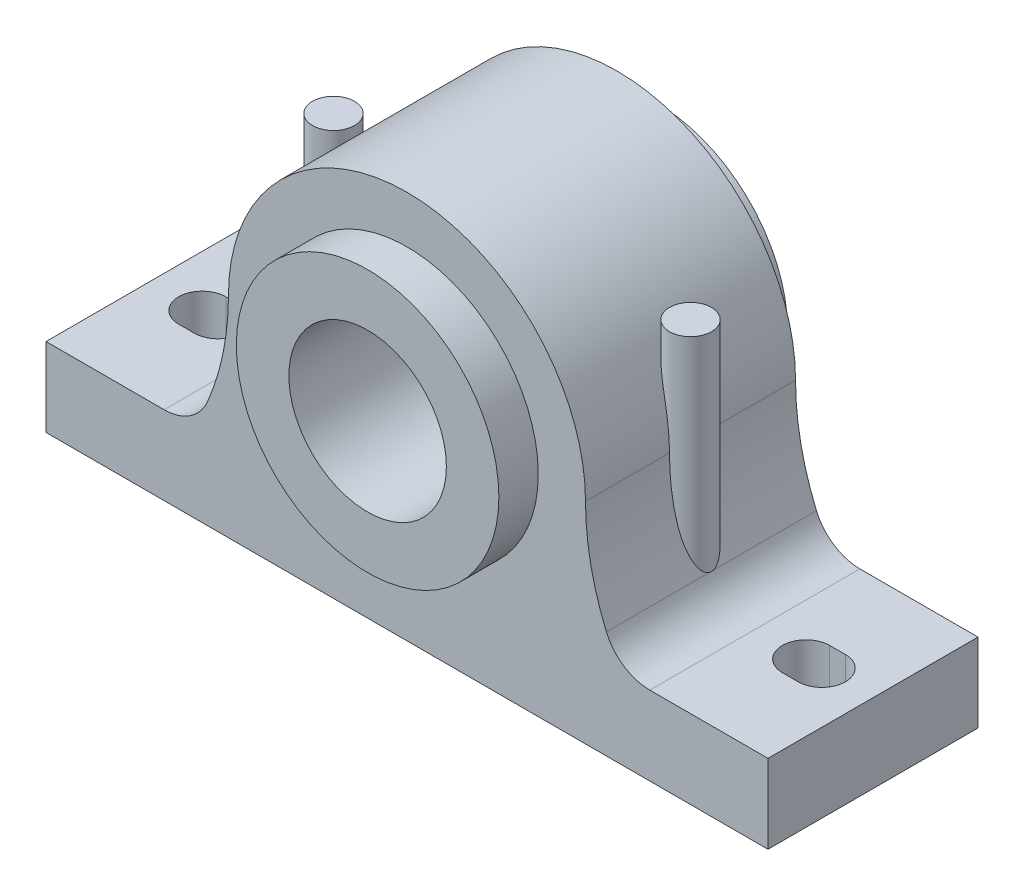
from build123d import *

# Parameters (mm, degrees)
SKETCH1_R                = 30
BOSS_EXTRUDE1_DEPTH      = 40
SKETCH2_R                = 50
SKETCH2_R_2              = 30
BOSS_EXTRUDE2_DEPTH      = 55
CUT_EXTRUDE1_DEPTH       = 110
BOSS_EXTRUDE3_DEPTH      = 40
BOSS_EXTRUDE3_DEPTH_BACK = 60
SKETCH5_R                = 8


with BuildPart() as part:
    # Sketch1 → Boss-Extrude1 (new, symmetric)
    with BuildSketch(Plane.XY):
        with BuildLine():
            Line((137.5, -80), (-137.5, -80))
            Line((-137.5, -80), (-137.5, -50))
            Line((-137.5, -50), (-92.5, -50))
            ThreePointArc((-92.5, -50), (-82.586036695, -47.018171653), (-75.961854895, -39.062156056))
            ThreePointArc((-75.961854895, -39.062156056), (-70.010718453, -19.932656428), (-68, 0))
            ThreePointArc((-68, 0), (0, 68), (68, 0))
            ThreePointArc((68, 0), (70.010718453, -19.932656428), (75.961854895, -39.062156056))
            ThreePointArc((75.961854895, -39.062156056), (82.586036695, -47.018171653), (92.5, -50))
            Line((92.5, -50), (137.5, -50))
            Line((137.5, -50), (137.5, -80))
        make_face()
        Circle(SKETCH1_R, mode=Mode.SUBTRACT)
    extrude(amount=BOSS_EXTRUDE1_DEPTH, both=True)

    # Sketch2 → Boss-Extrude2 (add, symmetric)
    with BuildSketch(Plane.XY):
        Circle(SKETCH2_R)
        Circle(SKETCH2_R_2, mode=Mode.SUBTRACT)
    extrude(amount=BOSS_EXTRUDE2_DEPTH, both=True)

    # Sketch3 → Cut-Extrude1 (cut)
    with BuildSketch(Plane(origin=(0, 0, 0), x_dir=(1, 0, 0), z_dir=(0, 1, 0))):
        with BuildLine():
            Line((-118, 9), (-112, 9))
            ThreePointArc((-112, 9), (-103, 0), (-112, -9))
            Line((-112, -9), (-118, -9))
            ThreePointArc((-118, -9), (-127, 0), (-118, 9))
        make_face()
        with BuildLine():
            Line((118, 9), (112, 9))
            ThreePointArc((112, 9), (103, 0), (112, -9))
            Line((112, -9), (118, -9))
            ThreePointArc((118, -9), (127, 0), (118, 9))
        make_face()
    extrude(amount=-CUT_EXTRUDE1_DEPTH, mode=Mode.SUBTRACT)

    # Sketch5 → Boss-Extrude3 (add, two sides: drawn at the far end of the back side and taken through both)
    with BuildSketch(Plane(origin=(0, 0, 0), x_dir=(1, 0, 0), z_dir=(0, 1, 0)).offset(-BOSS_EXTRUDE3_DEPTH_BACK)):
        with Locations(Location((-68, 0, 0), (0, 0, 270))):
            Circle(SKETCH5_R)
        with Locations(Location((68, 0, 0), (0, 0, 270))):
            Circle(SKETCH5_R)
    extrude(amount=BOSS_EXTRUDE3_DEPTH + BOSS_EXTRUDE3_DEPTH_BACK)


solid = part.part
